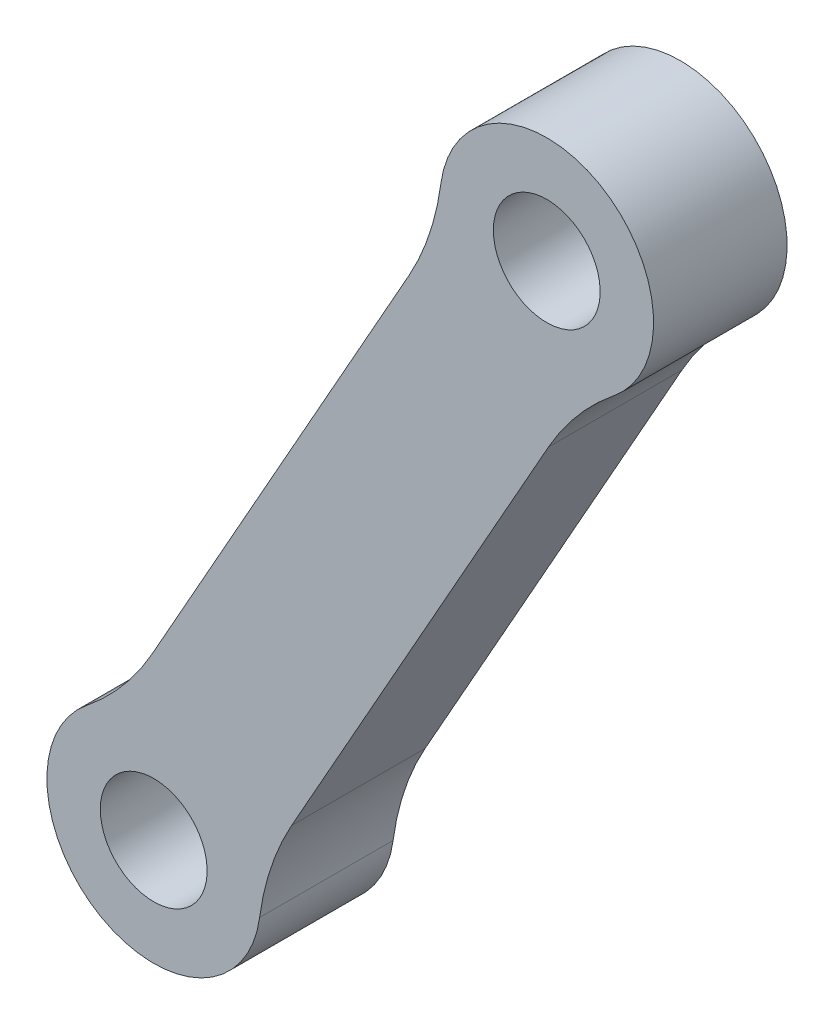
from build123d import *

# Parameters (mm, degrees)
SKETCH1_R           = 2
BOSS_EXTRUDE1_DEPTH = 5


with BuildPart() as part:
    # Sketch1 → Boss-Extrude1 (new body)
    with BuildSketch(Plane.XY.offset(63)):
        with BuildLine():
            Line((13.410115914, 15.199768317), (23.030358602, 32.285219435))
            ThreePointArc((23.030358602, 32.285219435), (24.114589128, 33.843533573), (25.473776059, 35.168867371))
            ThreePointArc((25.473776059, 35.168867371), (24.928229029, 41.770329198), (19.000782012, 38.813592536))
            ThreePointArc((19.000782012, 38.813592536), (18.572370652, 36.964170331), (17.802171103, 35.229035915))
            Line((17.802171103, 35.229035915), (8.181928414, 18.143584797))
            ThreePointArc((8.181928414, 18.143584797), (7.097697889, 16.585270658), (5.738510958, 15.259936861))
            ThreePointArc((5.738510958, 15.259936861), (6.284057988, 8.658475034), (12.211505005, 11.615211695))
            ThreePointArc((12.211505005, 11.615211695), (12.639916365, 13.464633901), (13.410115914, 15.199768317))
        make_face()
        with Locations(Location((8.246602308, 12.143933367, 0), (0, 0, 180))):
            Circle(SKETCH1_R, mode=Mode.SUBTRACT)
        with Locations(Location((22.965684708, 38.284870865, 0), (0, 0, 180))):
            Circle(SKETCH1_R, mode=Mode.SUBTRACT)
    extrude(amount=-BOSS_EXTRUDE1_DEPTH)


solid = part.part
